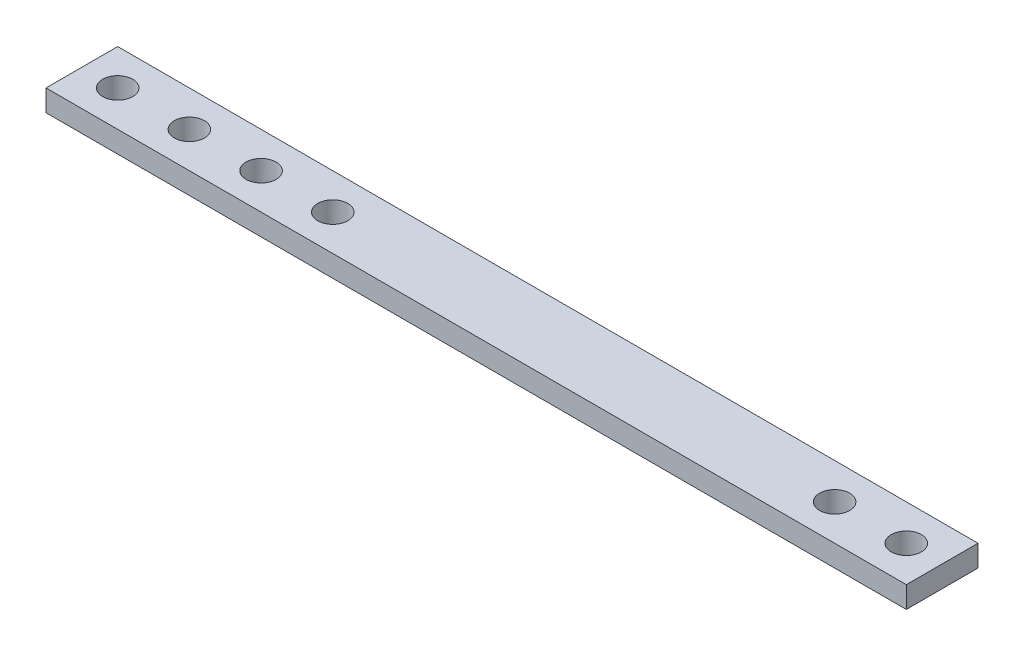
from build123d import *

# Parameters (mm, degrees)
CROQUIS1_W              = 120
CROQUIS1_H              = 10
CROQUIS1_R              = 2.1
SALIENTE_EXTRUIR1_DEPTH = 3
CROQUIS2_R              = 2.1
CORTAR_EXTRUIR1_DEPTH   = 3


with BuildPart() as part:
    # Croquis1 → Saliente-Extruir1 (new body)
    with BuildSketch(Plane(origin=(0, 0, 0), x_dir=(1, 0, 0), z_dir=(0, 1, 0))):
        Rectangle(CROQUIS1_W, CROQUIS1_H)
        with Locations(Location((-55, 0, 0), (0, 0, 270))):
            Circle(CROQUIS1_R, mode=Mode.SUBTRACT)
        with Locations(Location((-45, 0, 0), (0, 0, 270))):
            Circle(CROQUIS1_R, mode=Mode.SUBTRACT)
        with Locations(Location((-35, 0, 0), (0, 0, 270))):
            Circle(CROQUIS1_R, mode=Mode.SUBTRACT)
        with Locations(Location((-25, 0, 0), (0, 0, 270))):
            Circle(CROQUIS1_R, mode=Mode.SUBTRACT)
    extrude(amount=SALIENTE_EXTRUIR1_DEPTH)

    # Croquis2 → Cortar-Extruir1 (cut)
    with BuildSketch(Plane(origin=(0, 3, 0), x_dir=(1, 0, 0), z_dir=(0, 1, 0))):
        with Locations(Location((55, 0, 0), (0, 0, 270))):
            Circle(CROQUIS2_R)
        with Locations(Location((45, 0, 0), (0, 0, 270))):
            Circle(CROQUIS2_R)
    extrude(amount=-CORTAR_EXTRUIR1_DEPTH, mode=Mode.SUBTRACT)


solid = part.part
